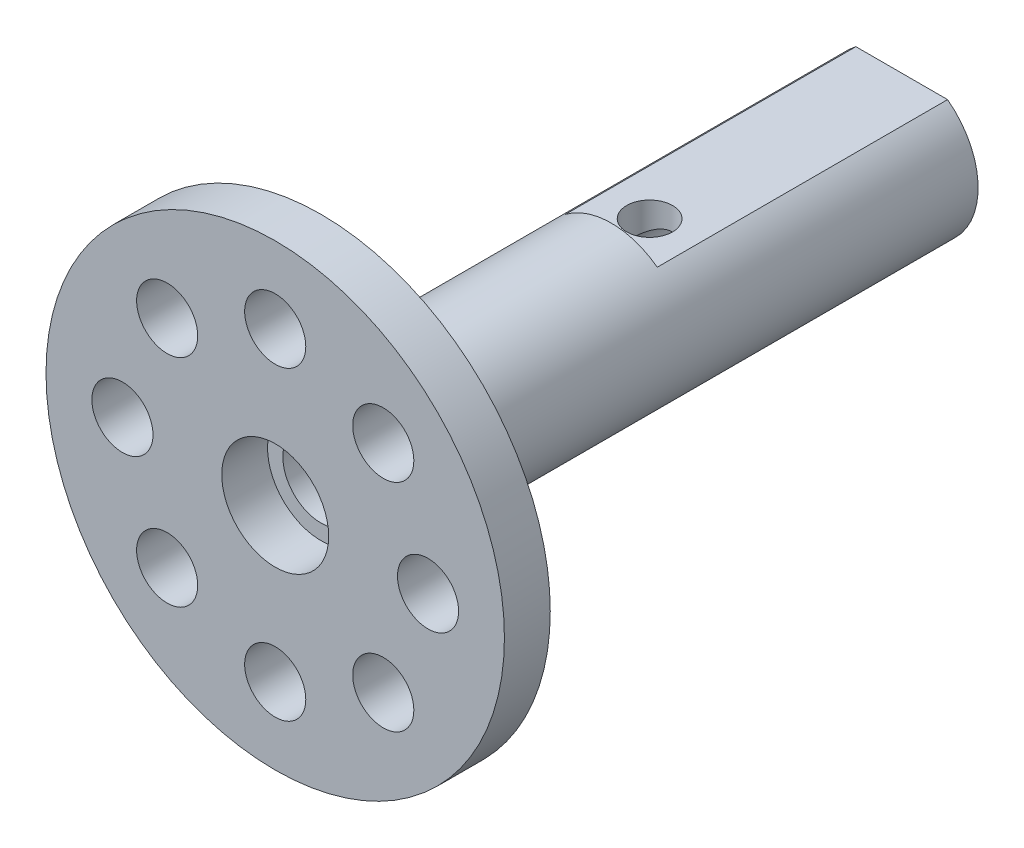
from build123d import *

# Parameters (mm, degrees)
SKETCH_1_R          = 5
EXTRUDE_1_DEPTH     = 35
SKETCH_2_R          = 6
EXTRUDE_2_DEPTH     = 3
SKETCH_3_R          = 15
SKETCH_3_R_2        = 2
EXTRUDE_3_DEPTH     = 3
CUT_EXTRUDE_1_DEPTH = 19
SKETCH_5_R          = 1.5
CUT_EXTRUDE_2_DEPTH = 48.613023428
SKETCH_6_R          = 2.5
CUT_EXTRUDE_3_DEPTH = 47.16275555
SKETCH_7_R          = 3.5
CUT_EXTRUDE_4_DEPTH = 3


with BuildPart() as part:
    # 草图1 → 凸台-拉伸1 (new body)
    with BuildSketch(Plane.XY):
        Circle(SKETCH_1_R)
    extrude(amount=EXTRUDE_1_DEPTH)

    # 草图2 → 凸台-拉伸2 (add)
    with BuildSketch(Plane.XY.offset(35)):
        Circle(SKETCH_2_R)
    extrude(amount=EXTRUDE_2_DEPTH)

    # 草图3 → 凸台-拉伸3 (add)
    with BuildSketch(Plane.XY.offset(38)):
        Circle(SKETCH_3_R)
        with Locations((0, 10)):
            Circle(SKETCH_3_R_2, mode=Mode.SUBTRACT)
        with Locations((10, 0)):
            Circle(SKETCH_3_R_2, mode=Mode.SUBTRACT)
        with Locations((0, -10)):
            Circle(SKETCH_3_R_2, mode=Mode.SUBTRACT)
        with Locations((-10, 0)):
            Circle(SKETCH_3_R_2, mode=Mode.SUBTRACT)
        with Locations((7.071067812, 7.071067812)):
            Circle(SKETCH_3_R_2, mode=Mode.SUBTRACT)
        with Locations((7.071067812, -7.071067812)):
            Circle(SKETCH_3_R_2, mode=Mode.SUBTRACT)
        with Locations((-7.071067812, -7.071067812)):
            Circle(SKETCH_3_R_2, mode=Mode.SUBTRACT)
        with Locations((-7.071067812, 7.071067812)):
            Circle(SKETCH_3_R_2, mode=Mode.SUBTRACT)
    extrude(amount=EXTRUDE_3_DEPTH)

    # 草图4 → 切除-拉伸1 (cut)
    with BuildSketch(Plane(origin=(0, 0, 0), x_dir=(-1, 0, 0), z_dir=(0, 0, -1))):
        with BuildLine():
            Line((-3, 4), (3, 4))
            ThreePointArc((3, 4), (0, 5), (-3, 4))
        make_face()
        with BuildLine():
            Line((-3, -4), (3, -4))
            ThreePointArc((3, -4), (0, -5), (-3, -4))
        make_face()
    extrude(amount=-CUT_EXTRUDE_1_DEPTH, mode=Mode.SUBTRACT)

    # 草图5 → 切除-拉伸2 (cut, through all)
    with BuildSketch(Plane(origin=(0, 4, 0), x_dir=(1, 0, 0), z_dir=(0, 1, 0))):
        with Locations(Location((0, -16.5, 0), (0, 0, 270))):
            Circle(SKETCH_5_R)
    extrude(amount=-CUT_EXTRUDE_2_DEPTH, mode=Mode.SUBTRACT)

    # 草图6 → 切除-拉伸3 (cut, through all)
    with BuildSketch(Plane(origin=(0, 0, 0), x_dir=(-1, 0, 0), z_dir=(0, 0, -1))):
        Circle(SKETCH_6_R)
    extrude(amount=-CUT_EXTRUDE_3_DEPTH, mode=Mode.SUBTRACT)

    # 草图7 → 切除-拉伸4 (cut)
    with BuildSketch(Plane.XY.offset(41)):
        Circle(SKETCH_7_R)
    extrude(amount=-CUT_EXTRUDE_4_DEPTH, mode=Mode.SUBTRACT)


solid = part.part
